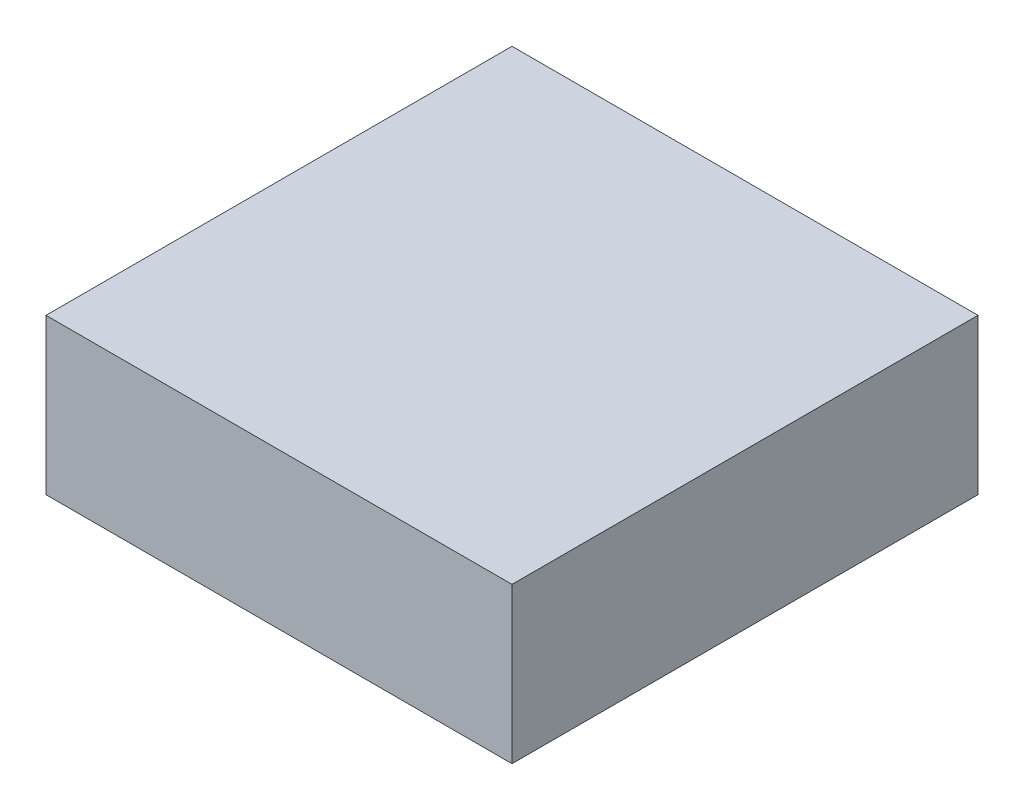
from build123d import *

# Parameters (mm, degrees)
SKETCH1_W           = 3
SKETCH1_H           = 3
BOSS_EXTRUDE1_DEPTH = 1


with BuildPart() as part:
    # Sketch1 → Boss-Extrude1 (new body)
    with BuildSketch(Plane(origin=(0, 0, 0), x_dir=(1, 0, 0), z_dir=(0, 1, 0))):
        with Locations((1.5, -1.5)):
            Rectangle(SKETCH1_W, SKETCH1_H)
    extrude(amount=BOSS_EXTRUDE1_DEPTH)


solid = part.part
